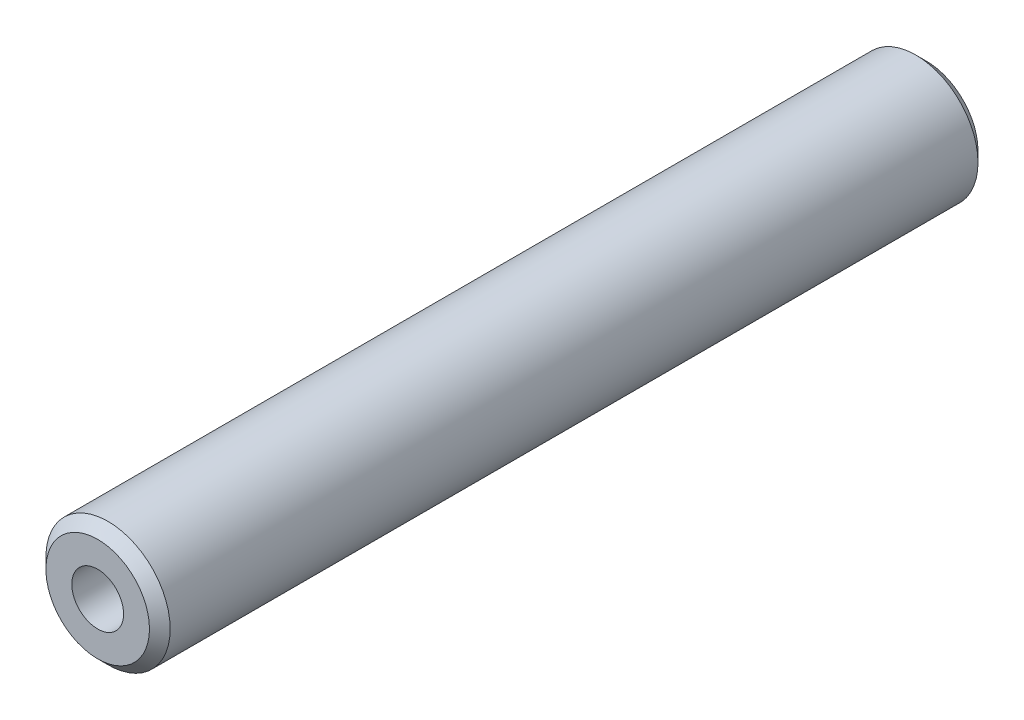
from build123d import *

# Parameters (mm, degrees)
SKETCH_2_R      = 3
EXTRUDE_1_DEPTH = 20
CHAMFER_1_SIZE  = 0.5


with BuildPart() as part:
    # ｽｹｯﾁ2 → ﾎﾞｽ - 押し出し1 (new, symmetric)
    with BuildSketch(Plane.XY):
        Circle(SKETCH_2_R)
    extrude(amount=EXTRUDE_1_DEPTH, both=True)

    # ｽｹｯﾁ4 → M3 ねじ穴1 (revolve, cut)
    with BuildSketch(Plane(origin=(0, 0, 20), x_dir=(0, -1, 0), z_dir=(1, 0, 0))):
        Polygon((0, 0), (0, 9.251075774), (1.25, 8.5), (1.25, 0), align=None)
    hole_wizard_m3_1 = revolve(axis=Axis((0, 0, 26.35), (0, 0, -1)), mode=Mode.SUBTRACT)

    # ﾐﾗｰ1: M3 ねじ穴1 across plane
    add(hole_wizard_m3_1.mirror(Plane.XY), mode=Mode.SUBTRACT)

    # 面取り1
    chamfer_1_edges = [part.edges().sort_by_distance(p)[0] for p in [
        (-3, 0, -20),
        (-3, 0, 20),
    ]]
    chamfer(chamfer_1_edges, length=CHAMFER_1_SIZE)


solid = part.part
